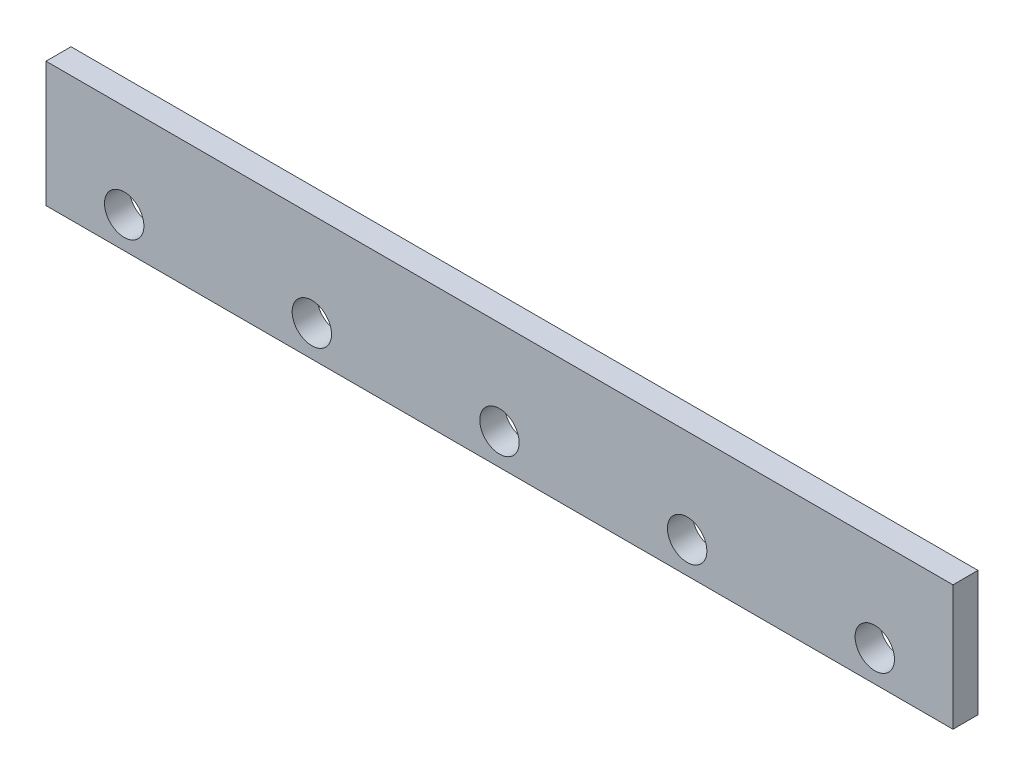
from build123d import *

# Parameters (mm, degrees)
CROQUIS1_W              = 580
CROQUIS1_H              = 80
CROQUIS1_R              = 12.6
SALIENTE_EXTRUIR1_DEPTH = 16


with BuildPart() as part:
    # Croquis1 → Saliente-Extruir1 (new body)
    with BuildSketch(Plane.XY):
        with Locations((-290, 40)):
            Rectangle(CROQUIS1_W, CROQUIS1_H)
        with Locations((-530, 20)):
            Circle(CROQUIS1_R, mode=Mode.SUBTRACT)
        with Locations((-410, 20)):
            Circle(CROQUIS1_R, mode=Mode.SUBTRACT)
        with Locations((-290, 20)):
            Circle(CROQUIS1_R, mode=Mode.SUBTRACT)
        with Locations((-170, 20)):
            Circle(CROQUIS1_R, mode=Mode.SUBTRACT)
        with Locations((-50, 20)):
            Circle(CROQUIS1_R, mode=Mode.SUBTRACT)
    extrude(amount=-SALIENTE_EXTRUIR1_DEPTH)


solid = part.part
